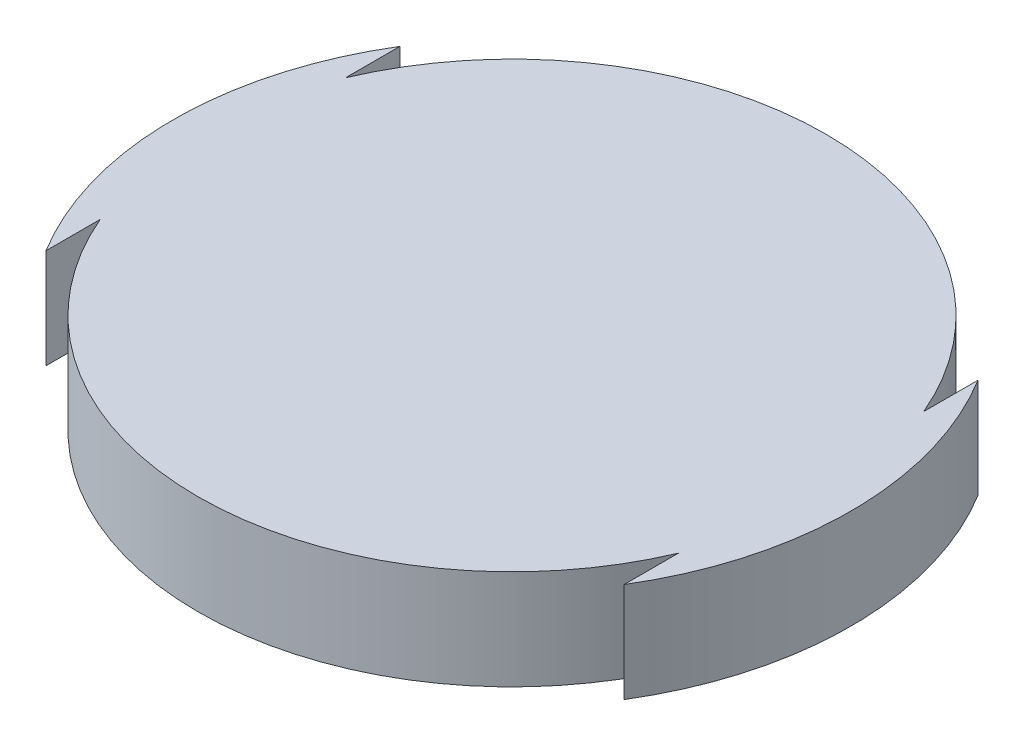
from build123d import *

# Parameters (mm, degrees)
SKETCH1_R           = 68
BOSS_EXTRUDE1_DEPTH = 20
CUT_EXTRUDE1_START  = -20
CUT_EXTRUDE1_DEPTH  = 20


with BuildPart() as part:
    # Sketch1 → Boss-Extrude1 (new body)
    with BuildSketch(Plane(origin=(0, 0, 0), x_dir=(1, 0, 0), z_dir=(0, 1, 0))):
        with Locations(Location((0, 0, 0), (0, 0, 270))):
            Circle(SKETCH1_R)
    extrude(amount=BOSS_EXTRUDE1_DEPTH)

    # Sketch2 → Cut-Extrude1 (cut)
    with BuildSketch(Plane(origin=(0, 20, 0), x_dir=(1, 0, 0), z_dir=(0, 1, 0)).offset(CUT_EXTRUDE1_START)):
        with BuildLine():
            Line((-58, -35.496478699), (-58, -24.596747752))
            ThreePointArc((-58, -24.596747752), (0, -63), (58, -24.596747752))
            Line((58, -24.596747752), (58, -35.496478699))
            ThreePointArc((58, -35.496478699), (0, -68), (-58, -35.496478699))
        make_face()
        with BuildLine():
            Line((58, 35.496478699), (58, 24.596747752))
            ThreePointArc((58, 24.596747752), (0, 63), (-58, 24.596747752))
            Line((-58, 24.596747752), (-58, 35.496478699))
            ThreePointArc((-58, 35.496478699), (0, 68), (58, 35.496478699))
        make_face()
    extrude(amount=CUT_EXTRUDE1_DEPTH, mode=Mode.SUBTRACT)


solid = part.part
